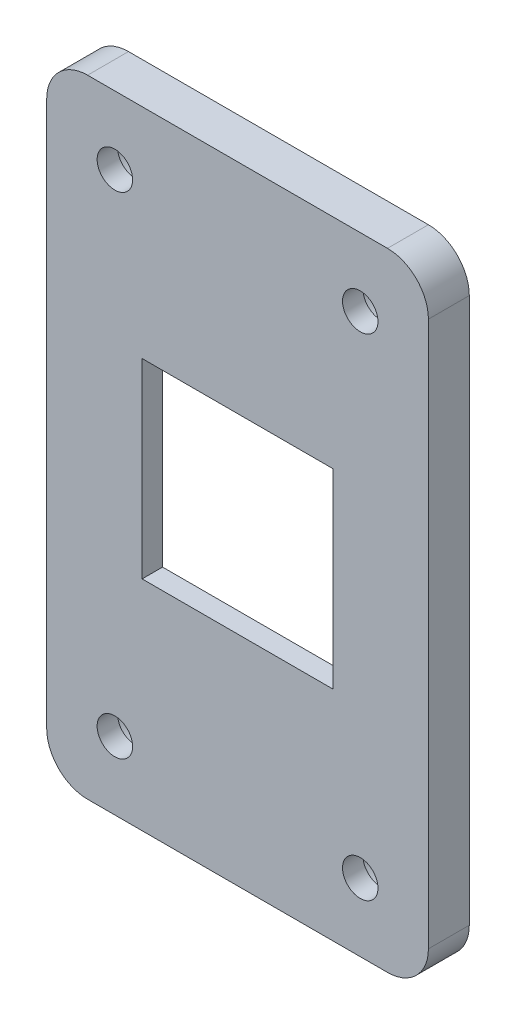
from build123d import *

# Parameters (mm, degrees)
SKETCH2_W                  = 46
SKETCH2_H                  = 28
SKETCH2_W_2                = 14
SKETCH2_H_2                = 14
BOSS_EXTRUDE1_DEPTH        = 3
F_2_6_2_6_DIAMETER_HOLE1_D = 2.6
SKETCH2_6_W                = 20
SKETCH2_6_H                = 20
SKETCH2_6_R                = 2.5
CUT_EXTRUDE2_DEPTH         = 1.5
FILLET1_R                  = 3


with BuildPart() as part:
    # Sketch2 → Boss-Extrude1 (new body)
    with BuildSketch(Plane(origin=(0, 0, 0), x_dir=(0, 1, 0), z_dir=(0, 0, 1))):
        Rectangle(SKETCH2_W, SKETCH2_H)
        Rectangle(SKETCH2_W_2, SKETCH2_H_2, mode=Mode.SUBTRACT)
    extrude(amount=BOSS_EXTRUDE1_DEPTH)

    # Ø2.6 (2.6) Diameter Hole1 (through all)
    with Locations(Plane(origin=(0, 0, 0), x_dir=(-1, 0, 0), z_dir=(0, 0, -1))):
        with Locations((-9, -18), (9, -18), (-9, 18), (9, 18)):
            Hole(F_2_6_2_6_DIAMETER_HOLE1_D / 2)

    # Sketch2<6> → Cut-Extrude2 (cut)
    with BuildSketch(Plane(origin=(0, 0, 0), x_dir=(0, 1, 0), z_dir=(0, 0, 1))):
        Rectangle(SKETCH2_6_W, SKETCH2_6_H)
        with Locations((-18, 9)):
            Circle(SKETCH2_6_R)
        with Locations((18, 9)):
            Circle(SKETCH2_6_R)
        with Locations((18, -9)):
            Circle(SKETCH2_6_R)
        with Locations((-18, -9)):
            Circle(SKETCH2_6_R)
    extrude(amount=CUT_EXTRUDE2_DEPTH, mode=Mode.SUBTRACT)

    # Fillet1
    fillet1_edges = [part.edges().sort_by_distance(p)[0] for p in [
        (14, 23, 1.5),
        (14, -23, 1.5),
        (-14, -23, 1.5),
        (-14, 23, 1.5),
    ]]
    fillet(fillet1_edges, radius=FILLET1_R)


solid = part.part
